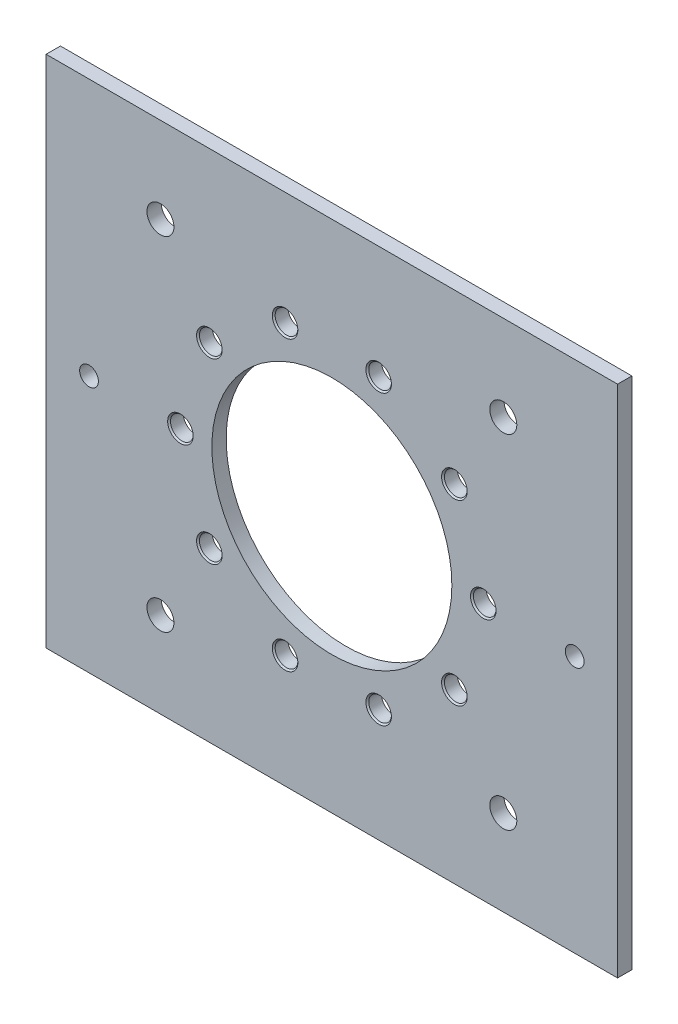
from build123d import *

# Parameters (mm, degrees)
SKETCH1_W                         = 254
SKETCH1_H                         = 228.6
SKETCH1_R                         = 53.34
BOSS_EXTRUDE1_DEPTH               = 6.35
F_3_8_CLEARANCE_HOLE1_D           = 10.0838
F_3_8_CLEARANCE_HOLE1_CSINK_D     = 11.3538
F_3_8_CLEARANCE_HOLE1_CSINK_ANGLE = 90
F_12_0_12_DIAMETER_HOLE1_D        = 12
SKETCH11_R                        = 4.1656
CUT_EXTRUDE1_DEPTH                = 171.978982627


with BuildPart() as part:
    # Sketch1 → Boss-Extrude1 (new body)
    with BuildSketch(Plane.XY):
        Rectangle(SKETCH1_W, SKETCH1_H)
        Circle(SKETCH1_R, mode=Mode.SUBTRACT)
    extrude(amount=BOSS_EXTRUDE1_DEPTH)

    # 3/8 Clearance Hole1 (through all)
    with Locations(Plane.XY.offset(6.35)):
        with Locations((-54.454933891, -39.563825332), (-67.31, 0), (-54.454933891, 39.563825332), (-20.799933891, 64.015614112), (20.799933891, 64.015614112), (54.454933891, 39.563825332), (67.31, 0), (54.454933891, -39.563825332), (20.799933891, -64.015614112), (-20.799933891, -64.015614112)):
            CounterSinkHole(F_3_8_CLEARANCE_HOLE1_D / 2, F_3_8_CLEARANCE_HOLE1_CSINK_D / 2, counter_sink_angle=F_3_8_CLEARANCE_HOLE1_CSINK_ANGLE)

    # Ø12.0 (12) Diameter Hole1 (through all)
    with Locations(Plane(origin=(0, 0, 0), x_dir=(-1, 0, 0), z_dir=(0, 0, -1))):
        with Locations((76.2, 76.2), (76.2, -76.2), (-76.2, -76.2), (-76.2, 76.2)):
            Hole(F_12_0_12_DIAMETER_HOLE1_D / 2)

    # Sketch11 → Cut-Extrude1 (cut, through all)
    with BuildSketch(Plane(origin=(0, 0, 0), x_dir=(-1, 0, 0), z_dir=(0, 0, -1))):
        with Locations((107.95, 0)):
            Circle(SKETCH11_R)
        with Locations(Location((-107.95, 0, 0), (0, 0, 180))):
            Circle(SKETCH11_R)
    extrude(amount=-CUT_EXTRUDE1_DEPTH, mode=Mode.SUBTRACT)


solid = part.part
